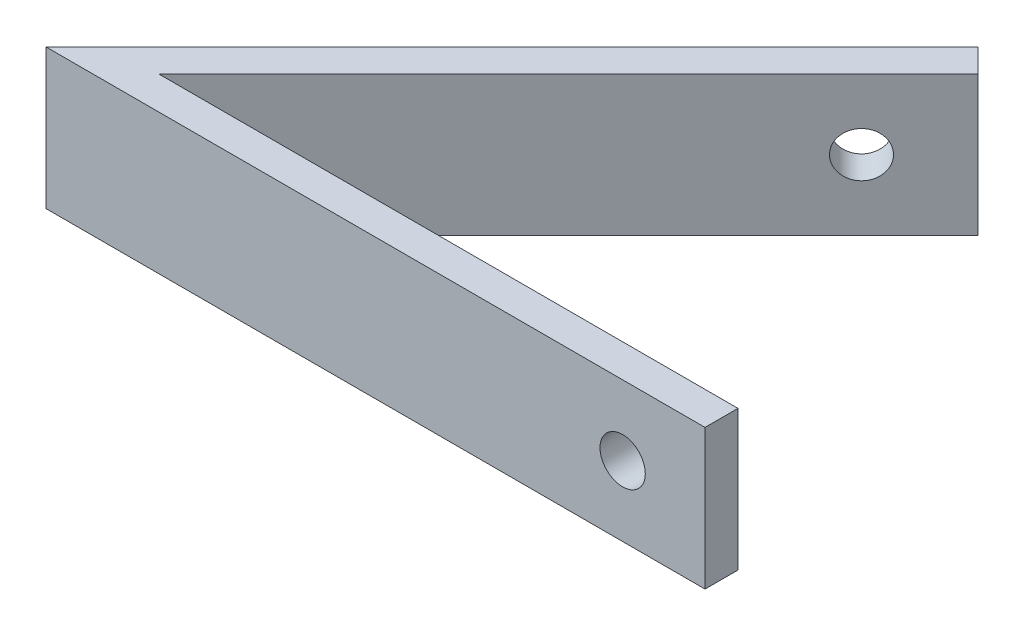
from build123d import *

# Parameters (mm, degrees)
EXTRUDE_1_DEPTH     = 17
SKETCH_2_R          = 2.75
CUT_EXTRUDE_1_DEPTH = 17
SKETCH_3_R          = 2.75
CUT_EXTRUDE_2_DEPTH = 17


with BuildPart() as part:
    # 草图1 → 凸台-拉伸1 (new body)
    with BuildSketch(Plane(origin=(0, 0, 0), x_dir=(1, 0, 0), z_dir=(0, 1, 0))):
        Polygon((80, 0), (0, 0), (56.568542495, 56.568542495), (59.39696962, 53.74011537), (9.656854249, 4), (80, 4), align=None)
    extrude(amount=EXTRUDE_1_DEPTH)

    # 草图2 → 切除-拉伸1 (cut)
    with BuildSketch(Plane(origin=(2.828427125, 0, 2.828427125), x_dir=(0.7071067811865476, 0, -0.7071067811865476), z_dir=(0.7071067811865476, 0, 0.7071067811865476))):
        with Locations((70, 8.5)):
            Circle(SKETCH_2_R)
    extrude(amount=-CUT_EXTRUDE_1_DEPTH, mode=Mode.SUBTRACT)

    # 草图3 → 切除-拉伸2 (cut)
    with BuildSketch(Plane.XY):
        with Locations((70, 8.5)):
            Circle(SKETCH_3_R)
    extrude(amount=-CUT_EXTRUDE_2_DEPTH, mode=Mode.SUBTRACT)


solid = part.part
